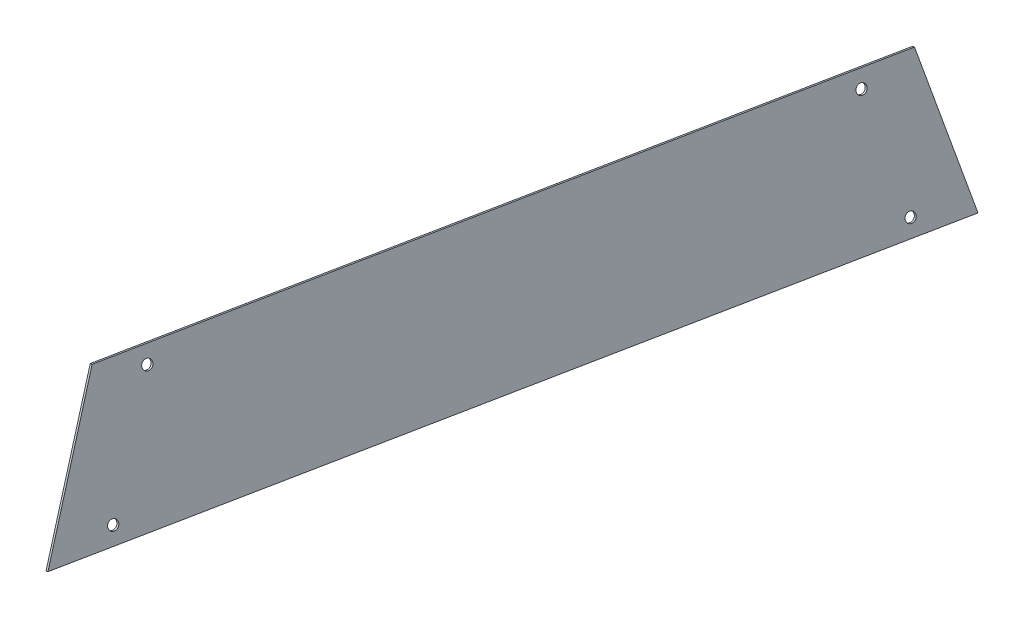
from build123d import *

# Parameters (mm, degrees)
BOSS_EXTRUDE1_DEPTH     = 1.5
CUT_EXTRUDE1_DEPTH      = 1854.670636641
CUT_EXTRUDE1_DEPTH_BACK = 1854.670636641
SKETCH3_R               = 2.75


with BuildPart() as part:
    # Sketch1 → Boss-Extrude1 (new body)
    with BuildSketch(Plane(origin=(661.48611704, 211.228421756, 131.566142626), x_dir=(0.17733557040624817, 0.05662751143705051, -0.9825199338523047), z_dir=(0.9359591821601212, 0.2988742708017776, 0.1861574053935612))):
        Polygon((-1754.379878986, 458.800897928), (-1797.099069003, 381.199102072), (-1334.09467717, 353.67598202), (-1345.012878923, 434.466232238), align=None)
    extrude(amount=BOSS_EXTRUDE1_DEPTH)

    # Sketch3 → Cut-Extrude1 (cut, two sides: drawn at the far end of the back side and taken through both)
    with BuildSketch(Plane(origin=(661.48611704, 211.228421756, 131.566142626), x_dir=(0.17733557040624817, 0.05662751143705051, -0.9825199338523047), z_dir=(0.9359591821601212, 0.2988742708017776, 0.1861574053935612)).offset(-CUT_EXTRUDE1_DEPTH_BACK)):
        with Locations(Location((-1729.277570286, 448.219803938, 0), (0, 0, 270))):
            Circle(SKETCH3_R)
        with Locations(Location((-1762.245431769, 388.21613765, 0), (0, 0, 270))):
            Circle(SKETCH3_R)
        with Locations(Location((-1365.280056563, 364.618681835, 0), (0, 0, 270))):
            Circle(SKETCH3_R)
        with Locations(Location((-1373.721769773, 427.083924548, 0), (0, 0, 270))):
            Circle(SKETCH3_R)
    extrude(amount=CUT_EXTRUDE1_DEPTH + CUT_EXTRUDE1_DEPTH_BACK, mode=Mode.SUBTRACT)


solid = part.part
